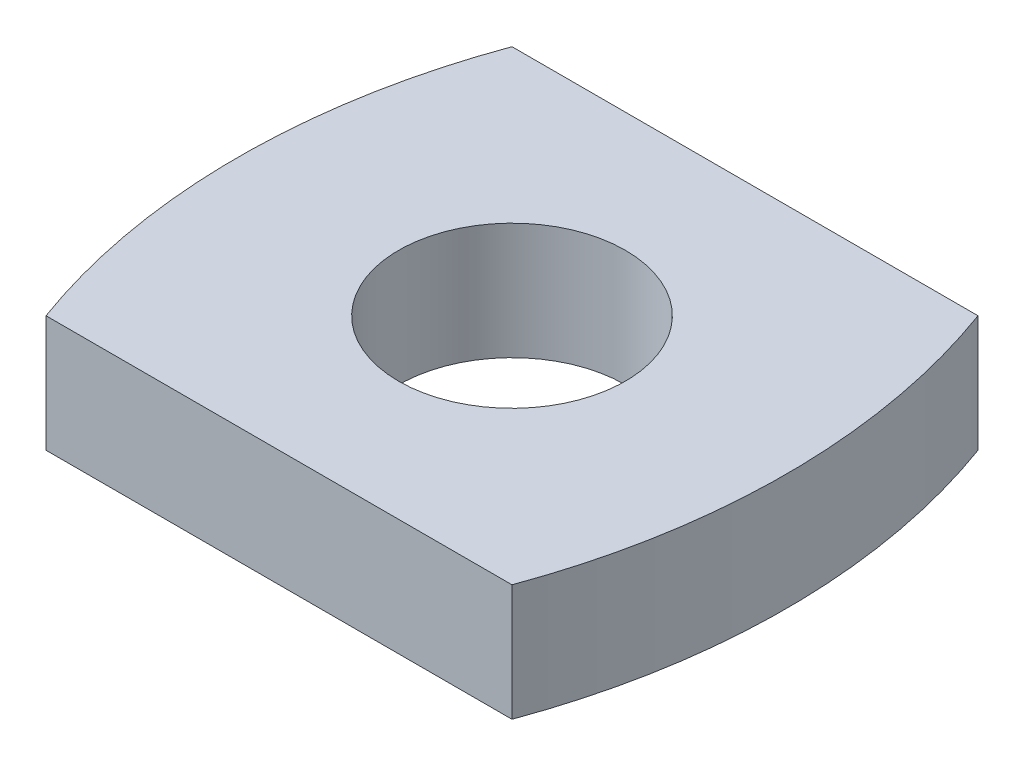
from build123d import *

# Parameters (mm, degrees)
SKETCH1_R           = 4.867044231
BOSS_EXTRUDE1_DEPTH = 5


with BuildPart() as part:
    # Sketch1 → Boss-Extrude1 (new body)
    with BuildSketch(Plane(origin=(0, 0, 0), x_dir=(1, 0, 0), z_dir=(0, 1, 0))):
        with BuildLine():
            Line((-10, -10), (10, -10))
            ThreePointArc((10, -10), (11.772851869, 0), (10, 10))
            Line((10, 10), (-10, 10))
            ThreePointArc((-10, 10), (-11.772851869, 0), (-10, -10))
        make_face()
        with Locations(Location((0, 0, 0), (0, 0, 270))):
            Circle(SKETCH1_R, mode=Mode.SUBTRACT)
    extrude(amount=BOSS_EXTRUDE1_DEPTH)


solid = part.part
